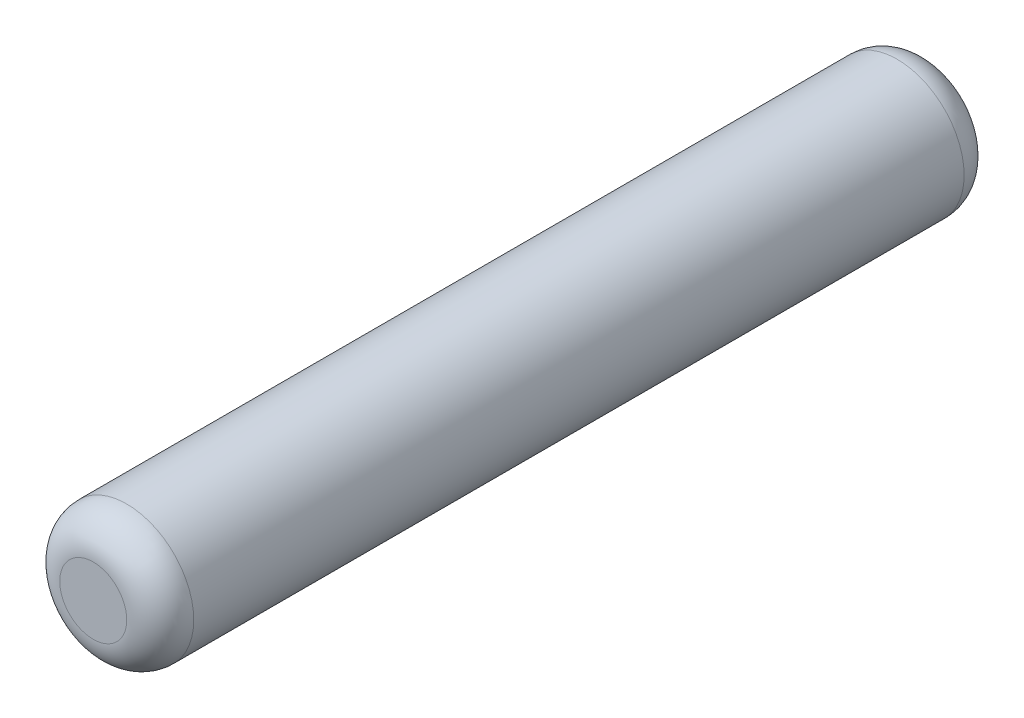
from build123d import *

# Parameters (mm, degrees)
SKETCH1_R           = 20
BOSS_EXTRUDE1_DEPTH = 250
FILLET1_R           = 10


with BuildPart() as part:
    # Sketch1 → Boss-Extrude1 (new body)
    with BuildSketch(Plane.XY):
        Circle(SKETCH1_R)
    extrude(amount=BOSS_EXTRUDE1_DEPTH)

    # Fillet1
    fillet1_edges = [part.edges().sort_by_distance(p)[0] for p in [
        (-20, 0, 0),
        (-20, 0, 250),
    ]]
    fillet(fillet1_edges, radius=FILLET1_R)


solid = part.part
